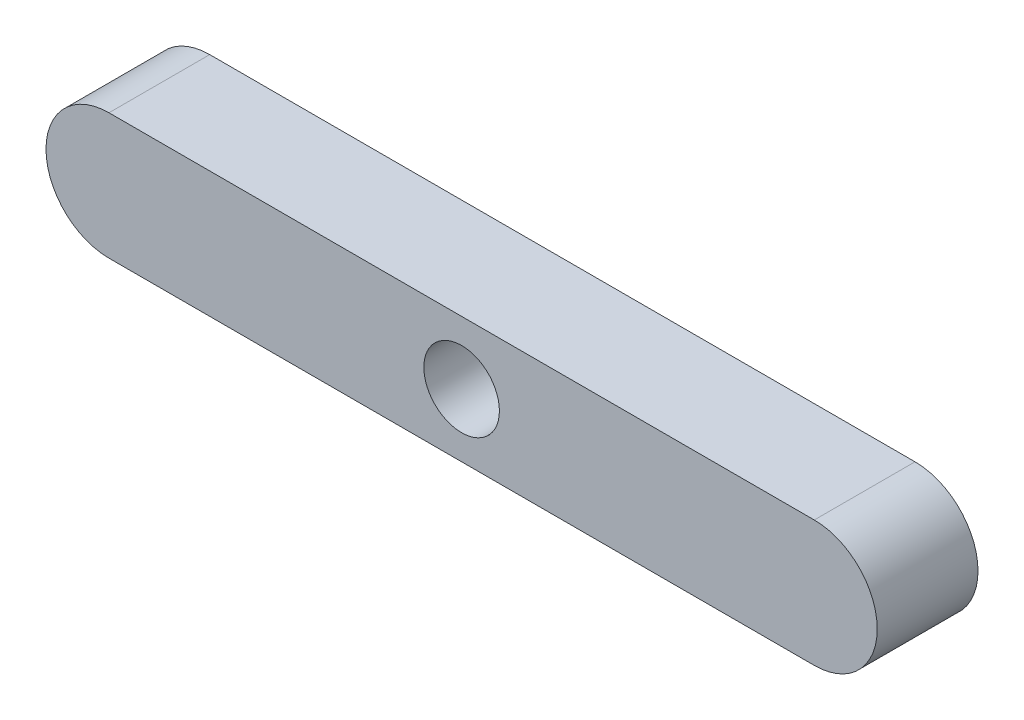
from build123d import *

# Parameters (mm, degrees)
SALIENTE_EXTRUIR1_DEPTH = 2
CROQUIS2_R              = 0.75
CORTAR_EXTRUIR1_DEPTH   = 2


with BuildPart() as part:
    # Croquis1 → Saliente-Extruir1 (new body)
    with BuildSketch(Plane.XY):
        with BuildLine():
            Line((0, -2.5), (0, 0))
            Line((0, 0), (-7, 0))
            ThreePointArc((-7, 0), (-8.25, -1.25), (-7, -2.5))
            Line((-7, -2.5), (0, -2.5))
        make_face()
        with BuildLine():
            Line((7, 0), (0, 0))
            Line((0, 0), (0, -2.5))
            Line((0, -2.5), (7, -2.5))
            ThreePointArc((7, -2.5), (8.25, -1.25), (7, 0))
        make_face()
    extrude(amount=SALIENTE_EXTRUIR1_DEPTH)

    # Croquis2 → Cortar-Extruir1 (cut)
    with BuildSketch(Plane.XY.offset(2)):
        with Locations((0, -1.25)):
            Circle(CROQUIS2_R)
    extrude(amount=-CORTAR_EXTRUIR1_DEPTH, mode=Mode.SUBTRACT)


solid = part.part
